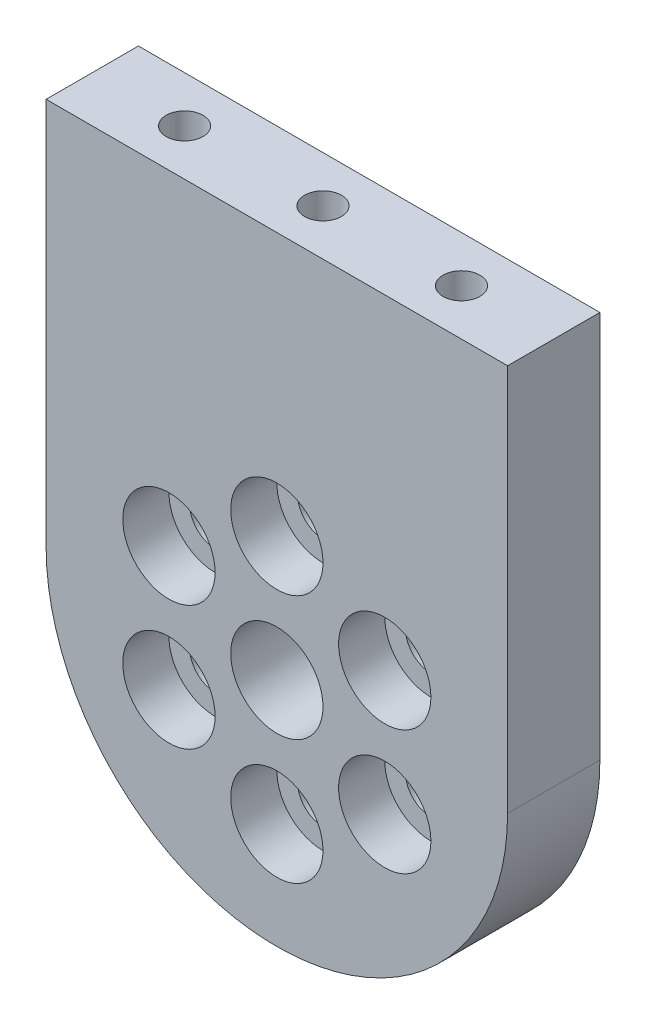
from build123d import *

# Parameters (mm, degrees)
SKETCH_1_R          = 5
SKETCH_1_R_2        = 2.75
EXTRUDE_1_DEPTH     = 10
SKETCH_2_R          = 2
CUT_EXTRUDE_1_DEPTH = 20
SKETCH_4_R          = 5
CUT_EXTRUDE_3_DEPTH = 5


with BuildPart() as part:
    # 스케치1 → 보스-돌출1 (new body)
    with BuildSketch(Plane.XY):
        with BuildLine():
            Line((25, 0), (25, 42))
            Line((25, 42), (-25, 42))
            Line((-25, 42), (-25, 0))
            ThreePointArc((-25, 0), (0, -25), (25, 0))
        make_face()
        Circle(SKETCH_1_R, mode=Mode.SUBTRACT)
        with Locations((0, -13.5)):
            Circle(SKETCH_1_R_2, mode=Mode.SUBTRACT)
        with Locations((-11.691342951, -6.75)):
            Circle(SKETCH_1_R_2, mode=Mode.SUBTRACT)
        with Locations((-11.691342951, 6.75)):
            Circle(SKETCH_1_R_2, mode=Mode.SUBTRACT)
        with Locations((0, 13.5)):
            Circle(SKETCH_1_R_2, mode=Mode.SUBTRACT)
        with Locations((11.691342951, 6.75)):
            Circle(SKETCH_1_R_2, mode=Mode.SUBTRACT)
        with Locations((11.691342951, -6.75)):
            Circle(SKETCH_1_R_2, mode=Mode.SUBTRACT)
    extrude(amount=EXTRUDE_1_DEPTH)

    # 스케치2 → 컷-돌출1 (cut)
    with BuildSketch(Plane(origin=(0, 42, 0), x_dir=(1, 0, 0), z_dir=(0, 1, 0))):
        with Locations(Location((0, -5, 0), (0, 0, 270))):
            Circle(SKETCH_2_R)
        with Locations(Location((15, -5, 0), (0, 0, 270))):
            Circle(SKETCH_2_R)
        with Locations(Location((-15, -5, 0), (0, 0, 270))):
            Circle(SKETCH_2_R)
    extrude(amount=-CUT_EXTRUDE_1_DEPTH, mode=Mode.SUBTRACT)

    # 스케치4 → 컷-돌출3 (cut)
    with BuildSketch(Plane.XY.offset(10)):
        with Locations((0, 13.5)):
            Circle(SKETCH_4_R)
        with Locations((11.691342951, 6.75)):
            Circle(SKETCH_4_R)
        with Locations((11.691342951, -6.75)):
            Circle(SKETCH_4_R)
        with Locations((0, -13.5)):
            Circle(SKETCH_4_R)
        with Locations((-11.691342951, -6.75)):
            Circle(SKETCH_4_R)
        with Locations((-11.691342951, 6.75)):
            Circle(SKETCH_4_R)
    extrude(amount=-CUT_EXTRUDE_3_DEPTH, mode=Mode.SUBTRACT)


solid = part.part
